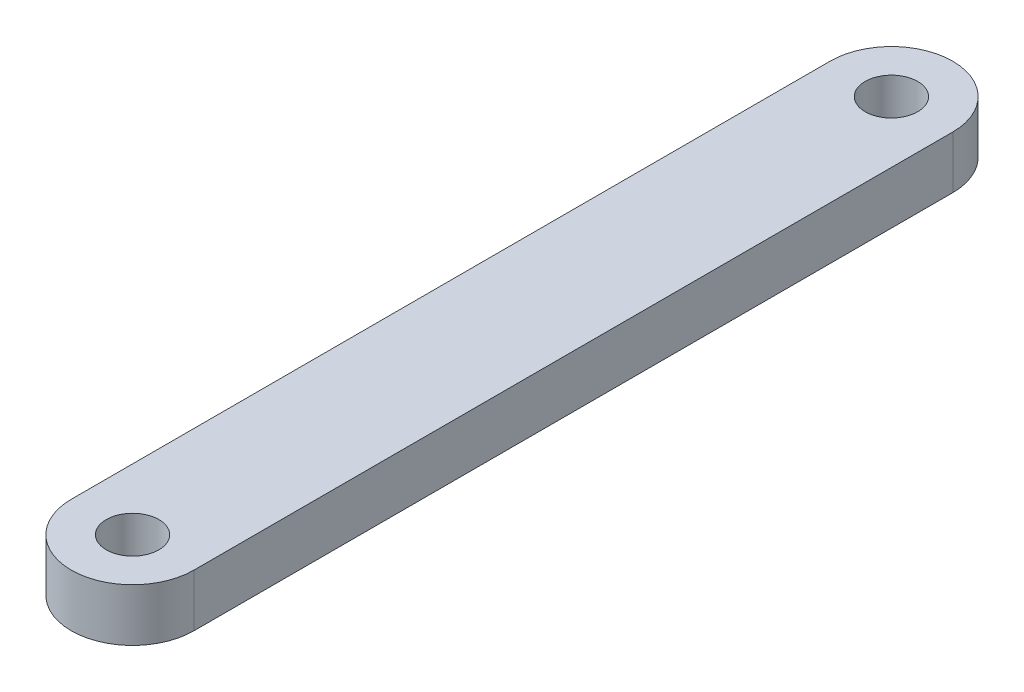
from build123d import *

# Parameters (mm, degrees)
EXTRUDE_1_DEPTH     = 3
SKETCH_2_R          = 1.5
CUT_EXTRUDE_1_DEPTH = 3


with BuildPart() as part:
    # 草图1 → 凸台-拉伸1 (new body)
    with BuildSketch(Plane(origin=(0, 0, 0), x_dir=(1, 0, 0), z_dir=(0, 1, 0))):
        with BuildLine():
            Line((-3.5, -21.65), (-3.5, 21.65))
            ThreePointArc((-3.5, 21.65), (0, 25.15), (3.5, 21.65))
            Line((3.5, 21.65), (3.5, -21.65))
            ThreePointArc((3.5, -21.65), (0, -25.15), (-3.5, -21.65))
        make_face()
    extrude(amount=EXTRUDE_1_DEPTH)

    # 草图2 → 切除-拉伸1 (cut)
    with BuildSketch(Plane(origin=(0, 3, 0), x_dir=(1, 0, 0), z_dir=(0, 1, 0))):
        with Locations(Location((0, 21.65, 0), (0, 0, 270))):
            Circle(SKETCH_2_R)
        with Locations(Location((0, -21.65, 0), (0, 0, 270))):
            Circle(SKETCH_2_R)
    extrude(amount=-CUT_EXTRUDE_1_DEPTH, mode=Mode.SUBTRACT)


solid = part.part
